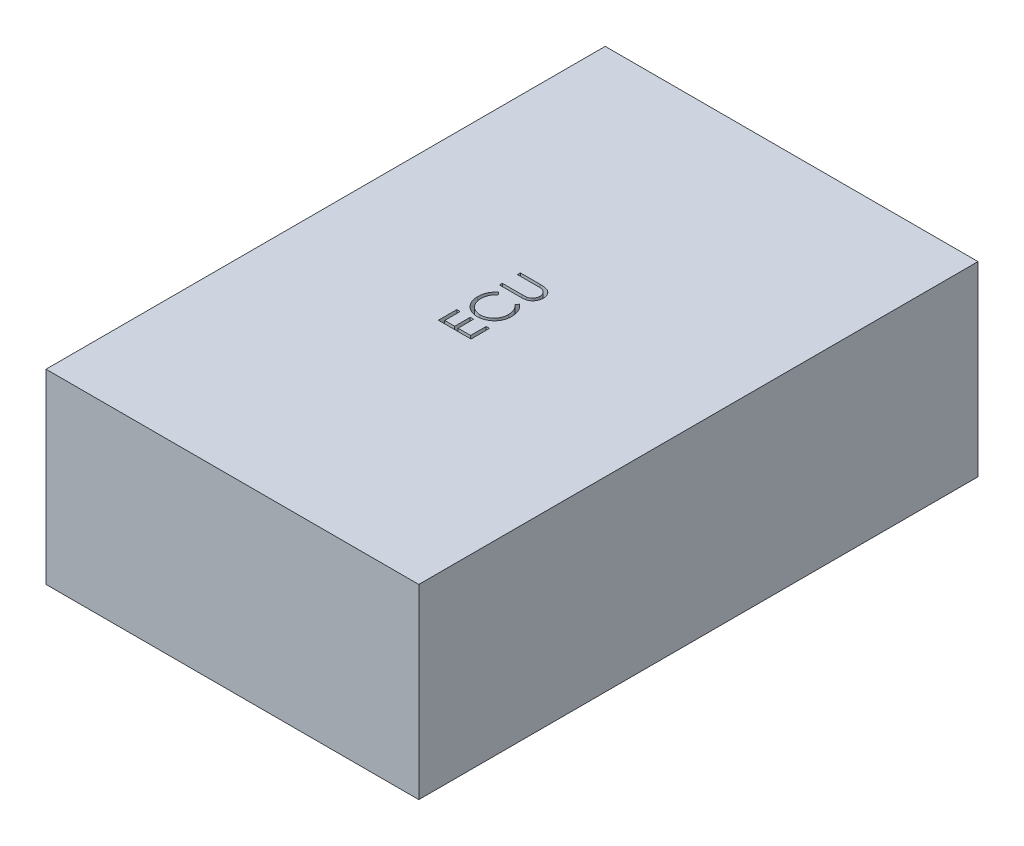
from build123d import *

# Parameters (mm, degrees)
SKETCH2_W           = 40
SKETCH2_H           = 60
BOSS_EXTRUDE1_DEPTH = 20
CUT_EXTRUDE1_DEPTH  = 2


with BuildPart() as part:
    # Sketch2 → Boss-Extrude1 (new body)
    with BuildSketch(Plane(origin=(0, 0, 0), x_dir=(1, 0, 0), z_dir=(0, 1, 0))):
        Rectangle(SKETCH2_W, SKETCH2_H)
    extrude(amount=BOSS_EXTRUDE1_DEPTH)

    # Sketch3 → Cut-Extrude1 (cut)
    with BuildSketch(Plane(origin=(0, 20, 0), x_dir=(1, 0, 0), z_dir=(0, 1, 0))):
        Polygon((-3.5, -4.397435897), (-3.5, -2.423076923), (-3.141025641, -2.423076923), (-3.141025641, -4.083333333), (-2.064102564, -4.083333333), (-2.064102564, -2.423076923), (-1.705128205, -2.423076923), (-1.705128205, -4.083333333), (-0.358974359, -4.083333333), (-0.358974359, -2.423076923), (0, -2.423076923), (0, -4.397435897), align=None)
        with BuildLine():
            Line((-2.857772436, 1.435897436), (-2.647435897, 1.161057692))
            add(Edge.make_bspline(
                [(-2.647435897, 1.161057692), (-2.670801558, 1.141451603), (-2.71721786, 1.102503757), (-2.782401946, 1.039847508), (-2.843450218, 0.974534815), (-2.90075492, 0.906656553), (-2.952012856, 0.834641861), (-3.001216038, 0.761234702), (-3.044295117, 0.683767868), (-3.096921601, 0.577190005), (-3.150639943, 0.437224347), (-3.196842354, 0.261639505), (-3.225976532, 0.078093687), (-3.229153365, -0.047099127), (-3.230769231, -0.110777244)],
                knots=[0, 0, 0, 0, 0.75789156, 1.505565099, 2.245254514, 2.979266606, 3.711207489, 4.440978832, 5.174393176, 5.91211879, 7.394186119, 8.890401545, 10.418332761, 12, 12, 12, 12], degree=3))
            add(Edge.make_bspline(
                [(-3.230769231, -0.110777244), (-3.230365268, -0.145860543), (-3.229561092, -0.215701536), (-3.218951967, -0.319350009), (-3.204040757, -0.42106306), (-3.181915434, -0.520774526), (-3.153942816, -0.618357486), (-3.120517398, -0.714449884), (-3.079162571, -0.8076605), (-3.033454265, -0.899278677), (-2.981826989, -0.987058114), (-2.925513027, -1.070112341), (-2.865146153, -1.148143301), (-2.800486887, -1.221194925), (-2.731875034, -1.289407417), (-2.658541914, -1.351922421), (-2.581271482, -1.409575186), (-2.499999569, -1.462037138), (-2.415483096, -1.509265078), (-2.327239526, -1.548976431), (-2.236779766, -1.583660059), (-2.143462522, -1.611536696), (-2.047908028, -1.63343013), (-1.949720428, -1.648566243), (-1.849085882, -1.659052416), (-1.780876687, -1.659852906), (-1.746494391, -1.66025641)],
                knots=[0, 0, 0, 0, 1.054877232, 2.099964208, 3.13098259, 4.145888998, 5.169474743, 6.183358035, 7.203388855, 8.234598956, 9.261847606, 10.264062591, 11.251197969, 12.227332808, 13.196685059, 14.158975844, 15.123498106, 16.094582253, 17.066912473, 18.032714859, 19.002806091, 19.979168736, 20.95977404, 21.949109834, 22.966205168, 24, 24, 24, 24], degree=3))
            add(Edge.make_bspline(
                [(-1.746494391, -1.66025641), (-1.694764224, -1.658991633), (-1.593198904, -1.656508409), (-1.444411923, -1.634502076), (-1.301737065, -1.600792686), (-1.166140367, -1.551098644), (-1.036491469, -1.488600503), (-0.914362627, -1.410620056), (-0.797964618, -1.319963211), (-0.690116535, -1.215699947), (-0.591604203, -1.101291105), (-0.504853252, -0.978543995), (-0.432538467, -0.847759496), (-0.372362494, -0.710382922), (-0.326105774, -0.565356793), (-0.293541649, -0.412941995), (-0.272299469, -0.253469998), (-0.27026578, -0.144500599), (-0.269230769, -0.089042468)],
                knots=[0, 0, 0, 0, 1.029159485, 2.020618137, 2.987588728, 3.942669054, 4.889339625, 5.846988364, 6.821327795, 7.821533711, 8.827683044, 9.822769455, 10.807800696, 11.797391277, 12.803701919, 13.832062008, 14.896664671, 16, 16, 16, 16], degree=3))
            add(Edge.make_bspline(
                [(-0.269230769, -0.089042468), (-0.270919549, -0.027939779), (-0.274243472, 0.09232493), (-0.302402721, 0.268692956), (-0.348060638, 0.437528722), (-0.411958561, 0.598841308), (-0.495023849, 0.752175955), (-0.595721726, 0.897772615), (-0.715010059, 1.035754185), (-0.806093187, 1.118725468), (-0.852564103, 1.161057692)],
                knots=[0, 0, 0, 0, 1.028121516, 2.023589091, 2.998037872, 3.967518031, 4.937445131, 5.927275754, 6.942489185, 8, 8, 8, 8], degree=3))
            Line((-0.852564103, 1.161057692), (-0.644330929, 1.435897436))
            add(Edge.make_bspline(
                [(-0.644330929, 1.435897436), (-0.615793465, 1.41377855), (-0.558855229, 1.369646728), (-0.478568872, 1.298200213), (-0.403119557, 1.222879947), (-0.332884076, 1.143492324), (-0.267571714, 1.059897421), (-0.207146992, 0.972102907), (-0.151930584, 0.880183723), (-0.101211602, 0.784869974), (-0.056555258, 0.685942027), (-0.016983214, 0.584270788), (0.015778067, 0.479232868), (0.043490435, 0.371712455), (0.063250601, 0.260738486), (0.078986048, 0.147600951), (0.088321482, 0.031240922), (0.089265301, -0.047192368), (0.08974359, -0.086939103)],
                knots=[0, 0, 0, 0, 0.986911346, 1.969095443, 2.935967484, 3.900112155, 4.865124501, 5.834589912, 6.812044781, 7.795288262, 8.784678562, 9.777857908, 10.776141921, 11.791195789, 12.811324908, 13.855933174, 14.913475973, 16, 16, 16, 16], degree=3))
            add(Edge.make_bspline(
                [(0.08974359, -0.086939103), (0.089481597, -0.12458277), (0.088963539, -0.19901846), (0.080571372, -0.308917211), (0.069121635, -0.415906792), (0.051881504, -0.519681418), (0.031537164, -0.620807393), (0.004265907, -0.718367978), (-0.026283259, -0.813323188), (-0.062188246, -0.905291529), (-0.102704429, -0.994351228), (-0.148495987, -1.08021504), (-0.199177852, -1.162843472), (-0.253632863, -1.243048893), (-0.313610164, -1.319646477), (-0.378276799, -1.393300002), (-0.44741481, -1.464422478), (-0.497269663, -1.508425163), (-0.522335737, -1.530548878)],
                knots=[0, 0, 0, 0, 1.114604814, 2.203992996, 3.262667896, 4.300477797, 5.318619304, 6.316056647, 7.298880507, 8.271930387, 9.238335007, 10.195173496, 11.151986948, 12.108099108, 13.064862484, 14.031167946, 15.010108607, 16, 16, 16, 16], degree=3))
            add(Edge.make_bspline(
                [(-0.522335737, -1.530548878), (-0.565877824, -1.56598221), (-0.65243632, -1.636421093), (-0.792709076, -1.726580806), (-0.939035305, -1.803499719), (-1.092262553, -1.866385737), (-1.252450387, -1.914689535), (-1.419341112, -1.948650245), (-1.592601104, -1.970565039), (-1.710436232, -1.973080401), (-1.770332532, -1.974358974)],
                knots=[0, 0, 0, 0, 0.994611881, 1.977215934, 2.950189954, 3.921972279, 4.908960509, 5.911694611, 6.938501887, 8, 8, 8, 8], degree=3))
            add(Edge.make_bspline(
                [(-1.770332532, -1.974358974), (-1.833287986, -1.972803781), (-1.95714891, -1.969744035), (-2.138922863, -1.943748239), (-2.313074262, -1.901929443), (-2.479278007, -1.842532554), (-2.638408287, -1.767227203), (-2.789249492, -1.674200589), (-2.932766292, -1.564533447), (-3.066781043, -1.439085879), (-3.189320396, -1.301518544), (-3.297126599, -1.15419973), (-3.386844115, -0.997417783), (-3.461840278, -0.832899931), (-3.519484741, -0.65941425), (-3.559837928, -0.477330881), (-3.584955044, -0.286991966), (-3.588130252, -0.15712954), (-3.58974359, -0.091145833)],
                knots=[0, 0, 0, 0, 1.032925535, 2.032216505, 3.007276963, 3.968222605, 4.92396291, 5.891752235, 6.871517503, 7.883894988, 8.900124299, 9.891468569, 10.874487609, 11.85992873, 12.854644235, 13.869047385, 14.917252991, 16, 16, 16, 16], degree=3))
            add(Edge.make_bspline(
                [(-3.58974359, -0.091145833), (-3.589261032, -0.050931493), (-3.588305858, 0.028668743), (-3.579005794, 0.146423307), (-3.563469843, 0.261058605), (-3.542435185, 0.372695198), (-3.515946277, 0.481655835), (-3.482932614, 0.58773667), (-3.443627527, 0.690677936), (-3.39874294, 0.790446192), (-3.348270478, 0.886367947), (-3.29280548, 0.978382982), (-3.232628195, 1.066124459), (-3.167122545, 1.149136335), (-3.09683189, 1.227520174), (-3.022579589, 1.302438727), (-2.94246027, 1.371711186), (-2.886053389, 1.414462854), (-2.857772436, 1.435897436)],
                knots=[0, 0, 0, 0, 1.096622143, 2.170653093, 3.219033441, 4.250379162, 5.267604342, 6.275621678, 7.278284436, 8.271072515, 9.257558938, 10.232633088, 11.19973724, 12.157384997, 13.114417402, 14.069920322, 15.032307892, 16, 16, 16, 16], degree=3))
        make_face()
        with BuildLine():
            Line((-3.5, 2.153846154), (-3.5, 2.467948718))
            Line((-3.5, 2.467948718), (-1.402944712, 2.467948718))
            add(Edge.make_bspline(
                [(-1.402944712, 2.467948718), (-1.373263976, 2.467901974), (-1.316939665, 2.467813269), (-1.236771364, 2.468405783), (-1.165498905, 2.470065152), (-1.102847558, 2.471111311), (-1.04910481, 2.473438645), (-1.0039795, 2.475336692), (-0.967685297, 2.477777248), (-0.946504371, 2.480710366), (-0.93739984, 2.481971154)],
                knots=[0, 0, 0, 0, 1.528628734, 2.90083645, 4.128790002, 5.200304208, 6.127813768, 6.898992206, 7.526736466, 8, 8, 8, 8], degree=3))
            add(Edge.make_bspline(
                [(-0.93739984, 2.481971154), (-0.904301233, 2.487089637), (-0.840405861, 2.496970639), (-0.749483191, 2.523222616), (-0.667388274, 2.558220731), (-0.592269338, 2.601637985), (-0.524603772, 2.656495874), (-0.463872235, 2.724603636), (-0.408682704, 2.804740193), (-0.360565368, 2.895757422), (-0.320599866, 2.992736438), (-0.290695413, 3.092200546), (-0.272393907, 3.192230089), (-0.27028033, 3.259208015), (-0.269230769, 3.292467949)],
                knots=[0, 0, 0, 0, 1.042777144, 2.01303441, 2.939567723, 3.817555404, 4.708046775, 5.641195415, 6.651191522, 7.732783915, 8.843021186, 9.914367358, 10.964315445, 12, 12, 12, 12], degree=3))
            add(Edge.make_bspline(
                [(-0.269230769, 3.292467949), (-0.270298667, 3.321024199), (-0.272428294, 3.377971768), (-0.285778381, 3.462540811), (-0.309364144, 3.545166497), (-0.341492259, 3.625199731), (-0.381001228, 3.701339835), (-0.428332331, 3.771634675), (-0.483463899, 3.834630264), (-0.544564893, 3.892117251), (-0.613418648, 3.941882428), (-0.688364059, 3.985882625), (-0.771399511, 4.020826872), (-0.82971969, 4.038519038), (-0.859575321, 4.047576122)],
                knots=[0, 0, 0, 0, 0.994718802, 1.98369237, 2.973235266, 3.981451368, 4.982709966, 5.955777334, 6.925228988, 7.892833478, 8.871333226, 9.877970804, 10.913677552, 12, 12, 12, 12], degree=3))
            add(Edge.make_bspline(
                [(-0.859575321, 4.047576122), (-0.871923895, 4.050576247), (-0.899441495, 4.057261735), (-0.945962785, 4.06350878), (-1.000852149, 4.070015306), (-1.064503962, 4.074529876), (-1.136704935, 4.078931096), (-1.217831192, 4.081564169), (-1.307588153, 4.082781202), (-1.370225315, 4.083143882), (-1.402944712, 4.083333333)],
                knots=[0, 0, 0, 0, 0.558680831, 1.244966039, 2.062412453, 2.990489873, 4.051219941, 5.244515665, 6.560634259, 8, 8, 8, 8], degree=3))
            Line((-1.402944712, 4.083333333), (-3.5, 4.083333333))
            Line((-3.5, 4.083333333), (-3.5, 4.397435897))
            Line((-3.5, 4.397435897), (-1.386117788, 4.397435897))
            add(Edge.make_bspline(
                [(-1.386117788, 4.397435897), (-1.348019417, 4.397181741), (-1.273668129, 4.396685739), (-1.164716665, 4.392385665), (-1.061364054, 4.38552689), (-0.963594286, 4.375844898), (-0.87176449, 4.362986978), (-0.785269805, 4.348820482), (-0.704587107, 4.330464199), (-0.628785526, 4.309182078), (-0.556264884, 4.285200035), (-0.48757401, 4.253593225), (-0.420695446, 4.218137526), (-0.356378054, 4.176425764), (-0.29503047, 4.128438197), (-0.235064641, 4.076013286), (-0.178267709, 4.017303202), (-0.123939175, 3.954042059), (-0.073413625, 3.886655192), (-0.029444943, 3.814707488), (0.006357487, 3.738596162), (0.038132849, 3.660123474), (0.060717967, 3.577407996), (0.077890464, 3.491480067), (0.087565929, 3.401830004), (0.089011549, 3.340866842), (0.08974359, 3.309995994)],
                knots=[0, 0, 0, 0, 1.316707045, 2.569633854, 3.76780728, 4.896239288, 5.964314126, 6.972204208, 7.924543903, 8.822147865, 9.693191779, 10.560896119, 11.431827672, 12.307838457, 13.206132673, 14.12176355, 15.058527151, 16.026630406, 17.00238624, 17.966538933, 18.934743273, 19.906713913, 20.888635248, 21.892958714, 22.933025263, 24, 24, 24, 24], degree=3))
            add(Edge.make_bspline(
                [(0.08974359, 3.309995994), (0.088959368, 3.276326645), (0.087420729, 3.210267504), (0.078590276, 3.112932919), (0.061999951, 3.019606031), (0.04073864, 2.929375991), (0.011894136, 2.843114523), (-0.023548065, 2.760847048), (-0.064010724, 2.681628964), (-0.111823734, 2.607245035), (-0.163960603, 2.537085066), (-0.221227237, 2.473325695), (-0.281442629, 2.414348387), (-0.346874192, 2.362752729), (-0.416182481, 2.316587201), (-0.489693486, 2.276869085), (-0.567308662, 2.242752612), (-0.621262289, 2.225146483), (-0.64853766, 2.216245994)],
                knots=[0, 0, 0, 0, 1.138939089, 2.234594419, 3.301501784, 4.342532435, 5.367382236, 6.373123747, 7.370098489, 8.372230273, 9.360297234, 10.323289009, 11.268038109, 12.20748145, 13.137029304, 14.081414587, 15.030090602, 16, 16, 16, 16], degree=3))
            add(Edge.make_bspline(
                [(-0.64853766, 2.216245994), (-0.667170235, 2.211068835), (-0.707584704, 2.199839464), (-0.774471192, 2.187814166), (-0.85148611, 2.177705085), (-0.938634728, 2.168199527), (-1.035984595, 2.162590569), (-1.143493511, 2.15767313), (-1.261291472, 2.153811511), (-1.343345988, 2.153834283), (-1.386117788, 2.153846154)],
                knots=[0, 0, 0, 0, 0.625038921, 1.35572334, 2.194682327, 3.136881307, 4.189498639, 5.346923369, 6.617055217, 8, 8, 8, 8], degree=3))
            Line((-1.386117788, 2.153846154), (-3.5, 2.153846154))
        make_face()
    extrude(amount=-CUT_EXTRUDE1_DEPTH, mode=Mode.SUBTRACT)


solid = part.part
